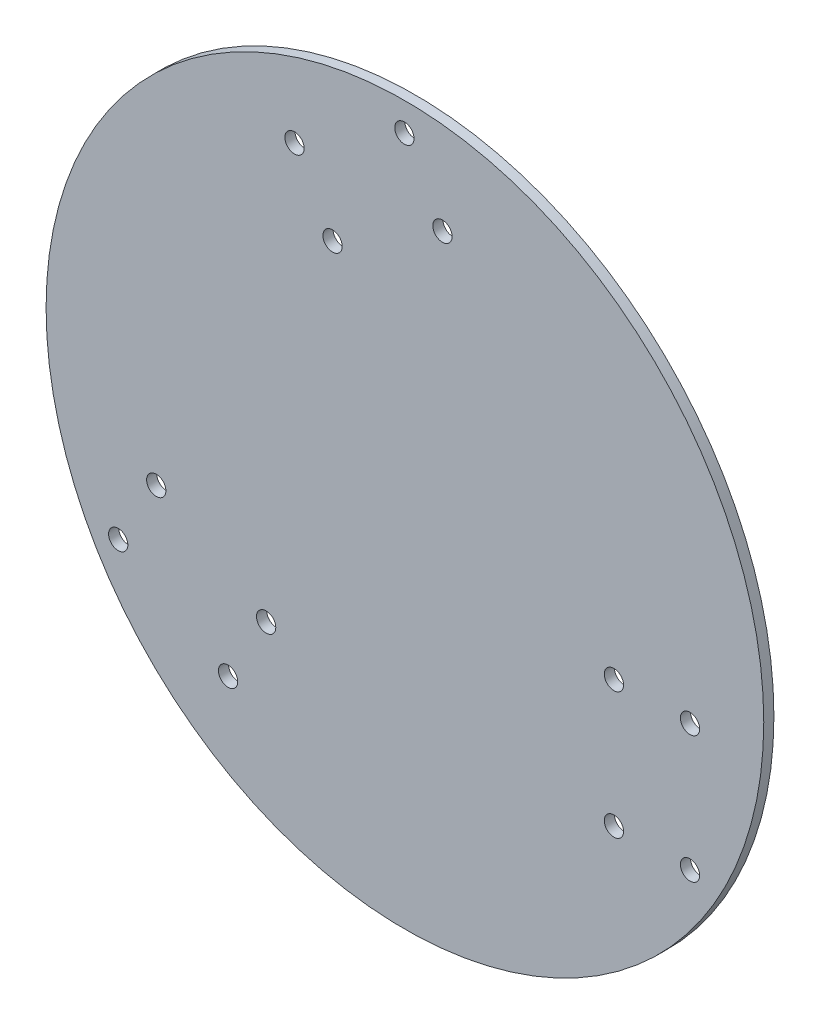
from build123d import *

# Parameters (mm, degrees)
SKETCH_1_R               = 70.710678119
EXTRUDE_1_DEPTH          = 2
SKETCH_2_R               = 1.9
CUT_EXTRUDE_2_DEPTH      = 101.019998
PATTERN_CIRCULAR_1_COUNT = 3


with BuildPart() as part:
    # ｽｹｯﾁ1 → ﾎﾞｽ - 押し出し1 (new body)
    with BuildSketch(Plane.XY):
        Circle(SKETCH_1_R)
    extrude(amount=EXTRUDE_1_DEPTH)

    # ｽｹｯﾁ2 → ｶｯﾄ - 押し出し2 (cut, symmetric)
    with BuildSketch(Plane.XY):
        with Locations((41.18, -7.5)):
            Circle(SKETCH_2_R)
        with Locations((41.18, -32.5)):
            Circle(SKETCH_2_R)
        with Locations((56.18, -32.5)):
            Circle(SKETCH_2_R)
        with Locations((56.18, -7.5)):
            Circle(SKETCH_2_R)
    cut_extrude_2 = extrude(amount=CUT_EXTRUDE_2_DEPTH, both=True, mode=Mode.SUBTRACT)

    # 円形ﾊﾟﾀｰﾝ1: ｶｯﾄ - 押し出し2 ×3 about axis
    pattern_circular_1_axis = Axis((-0.140995034, 0.057927294, 0), (0, 0, 1))
    for i in range(1, PATTERN_CIRCULAR_1_COUNT):
        add(cut_extrude_2.rotate(pattern_circular_1_axis, i * 360 / PATTERN_CIRCULAR_1_COUNT), mode=Mode.SUBTRACT)


solid = part.part
